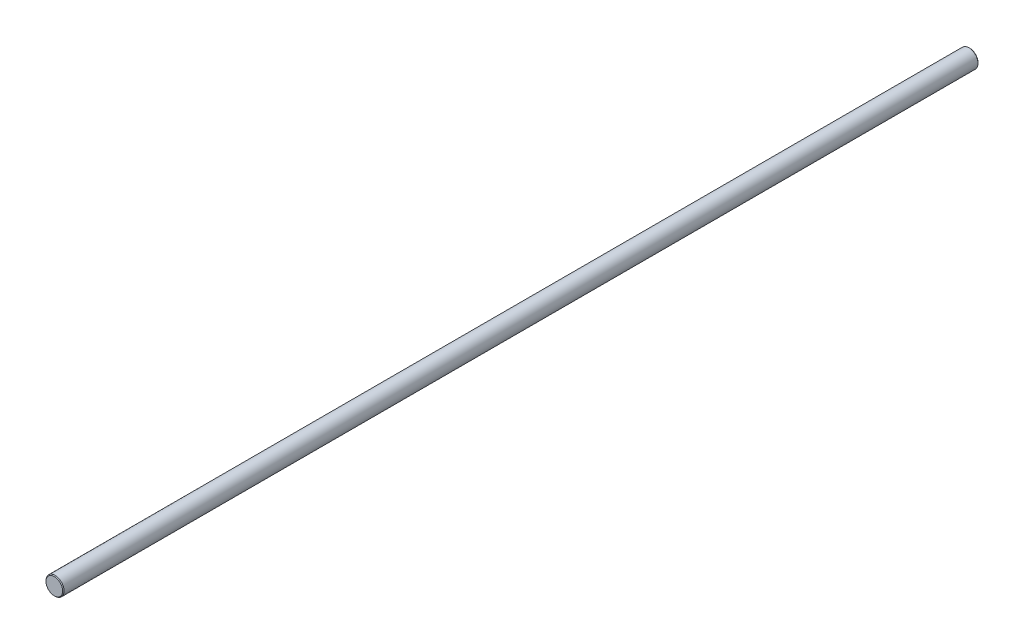
from build123d import *

# Parameters (mm, degrees)
SKETCH_1_R      = 12.5
EXTRUDE_1_DEPTH = 632
CHAMFER_1_SIZE  = 1


with BuildPart() as part:
    # Эскиз1 → Бобышка-Вытянуть1 (new, symmetric)
    with BuildSketch(Plane.XY):
        Circle(SKETCH_1_R)
    extrude(amount=EXTRUDE_1_DEPTH, both=True)

    # Фаска1
    chamfer_1_edges = [part.edges().sort_by_distance(p)[0] for p in [
        (-12.5, 0, -632),
        (-12.5, 0, 632),
    ]]
    chamfer(chamfer_1_edges, length=CHAMFER_1_SIZE)


solid = part.part
